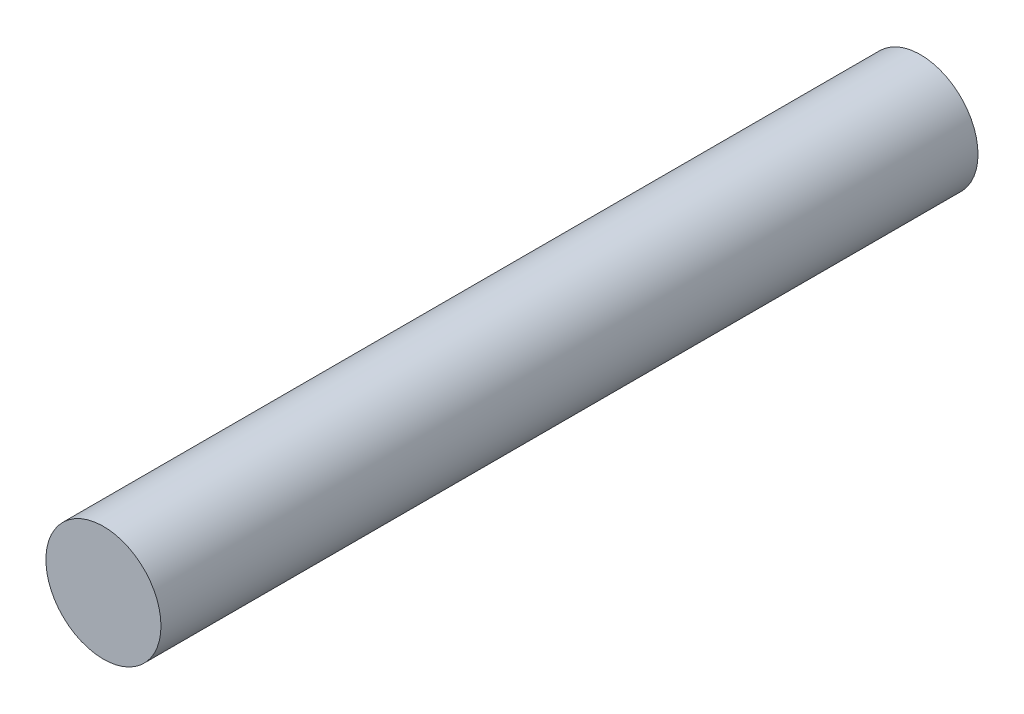
from build123d import *

# Parameters (mm, degrees)
SKETCH1_R           = 4
BOSS_EXTRUDE1_DEPTH = 56.8


with BuildPart() as part:
    # Sketch1 → Boss-Extrude1 (new body)
    with BuildSketch(Plane.XY):
        Circle(SKETCH1_R)
    extrude(amount=BOSS_EXTRUDE1_DEPTH)


solid = part.part
